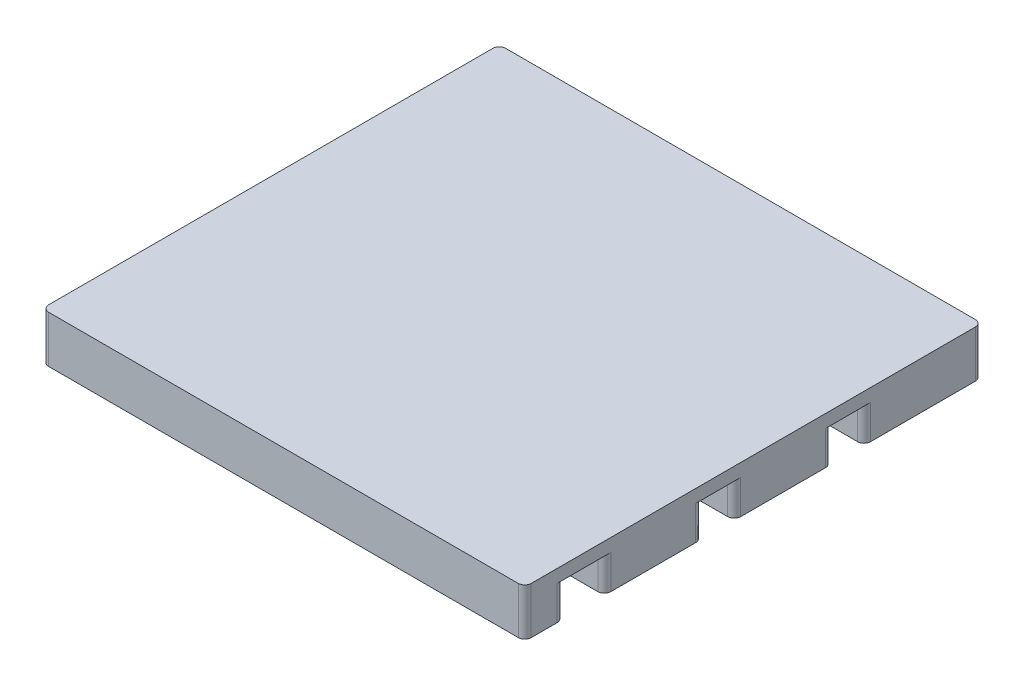
from build123d import *

# Parameters (mm, degrees)
SKETCH3_W           = 149
SKETCH3_H           = 141.12
BOSS_EXTRUDE1_DEPTH = 4
SKETCH5_W           = 67
SKETCH5_H           = 30.2
SKETCH5_H_2         = 36.35
BOSS_EXTRUDE2_DEPTH = 14.5
FILLET1_R           = 2
SKETCH6_W           = 149
SKETCH6_H           = 12
BOSS_EXTRUDE3_DEPTH = 10.5
FILLET2_R           = 2


with BuildPart() as part:
    # Sketch3 → Boss-Extrude1 (new body)
    with BuildSketch(Plane(origin=(0, 0, 0), x_dir=(1, 0, 0), z_dir=(0, 1, 0))):
        with Locations((74.5, -70.56)):
            Rectangle(SKETCH3_W, SKETCH3_H)
    extrude(amount=BOSS_EXTRUDE1_DEPTH)

    # Sketch5 → Boss-Extrude2 (add)
    # profile 1 of 6: a face of its own
    with BuildSketch(Plane(origin=(0, 4, 0), x_dir=(1, 0, 0), z_dir=(0, 1, 0))):
        with Locations((33.5, -23.8)):
            Rectangle(SKETCH5_W, SKETCH5_H)
        with BuildLine():
            ThreePointArc((13, -27.9), (9.9, -24.8), (13, -21.7))
            Line((13, -21.7), (41, -21.7))
            ThreePointArc((41, -21.7), (44.1, -24.8), (41, -27.9))
            Line((41, -27.9), (13, -27.9))
        make_face(mode=Mode.SUBTRACT)
    # profile 2 of 6: a face of its own
    with BuildSketch(Plane(origin=(0, 4, 0), x_dir=(1, 0, 0), z_dir=(0, 1, 0))):
        with Locations((115.5, -18.175)):
            Rectangle(SKETCH5_W, SKETCH5_H_2)
        with BuildLine():
            ThreePointArc((97, -25.35), (93.9, -22.25), (97, -19.15))
            Line((97, -19.15), (125, -19.15))
            ThreePointArc((125, -19.15), (128.1, -22.25), (125, -25.35))
            Line((125, -25.35), (97, -25.35))
        make_face(mode=Mode.SUBTRACT)
    # profile 3 of 6: a face of its own
    with BuildSketch(Plane(origin=(0, 4, 0), x_dir=(1, 0, 0), z_dir=(0, 1, 0))):
        with Locations((33.5, -63.9)):
            Rectangle(SKETCH5_W, SKETCH5_H)
        with BuildLine():
            ThreePointArc((13, -68), (9.9, -64.9), (13, -61.8))
            Line((13, -61.8), (41, -61.8))
            ThreePointArc((41, -61.8), (44.1, -64.9), (41, -68))
            Line((41, -68), (13, -68))
        make_face(mode=Mode.SUBTRACT)
    # profile 4 of 6: a face of its own
    with BuildSketch(Plane(origin=(0, 4, 0), x_dir=(1, 0, 0), z_dir=(0, 1, 0))):
        with Locations((115.5, -61.35)):
            Rectangle(SKETCH5_W, SKETCH5_H)
        with BuildLine():
            ThreePointArc((97, -65.45), (93.9, -62.35), (97, -59.25))
            Line((97, -59.25), (125, -59.25))
            ThreePointArc((125, -59.25), (128.1, -62.35), (125, -65.45))
            Line((125, -65.45), (97, -65.45))
        make_face(mode=Mode.SUBTRACT)
    # profile 5 of 6: a face of its own
    with BuildSketch(Plane(origin=(0, 4, 0), x_dir=(1, 0, 0), z_dir=(0, 1, 0))):
        with Locations((33.5, -104)):
            Rectangle(SKETCH5_W, SKETCH5_H)
        with BuildLine():
            ThreePointArc((13, -108.1), (9.9, -105), (13, -101.9))
            Line((13, -101.9), (41, -101.9))
            ThreePointArc((41, -101.9), (44.1, -105), (41, -108.1))
            Line((41, -108.1), (13, -108.1))
        make_face(mode=Mode.SUBTRACT)
    # profile 6 of 6: a face of its own
    with BuildSketch(Plane(origin=(0, 4, 0), x_dir=(1, 0, 0), z_dir=(0, 1, 0))):
        with Locations((115.5, -101.45)):
            Rectangle(SKETCH5_W, SKETCH5_H)
        with BuildLine():
            ThreePointArc((97, -105.55), (93.9, -102.45), (97, -99.35))
            Line((97, -99.35), (125, -99.35))
            ThreePointArc((125, -99.35), (128.1, -102.45), (125, -105.55))
            Line((125, -105.55), (97, -105.55))
        make_face(mode=Mode.SUBTRACT)
    extrude(amount=-BOSS_EXTRUDE2_DEPTH)

    # Fillet1
    fillet1_edges = [part.edges().sort_by_distance(p)[0] for p in [
        (67, -5.25, 48.8),
        (67, -5.25, 79),
        (0, -5.25, 79),
        (0, -5.25, 48.8),
        (82, -5.25, 46.25),
        (149, -5.25, 46.25),
        (149, -5.25, 76.45),
        (82, -5.25, 76.45),
        (67, -5.25, 88.9),
        (67, -5.25, 119.1),
        (0, -5.25, 119.1),
        (0, -5.25, 88.9),
        (82, -5.25, 86.35),
        (149, -5.25, 86.35),
        (149, -5.25, 116.55),
        (82, -5.25, 116.55),
        (67, -5.25, 8.7),
        (67, -5.25, 38.9),
        (0, -5.25, 38.9),
        (0, -5.25, 8.7),
        (82, -5.25, 0),
        (149, -5.25, 36.35),
        (82, -5.25, 36.35),
        (149, -3.25, 0),
    ]]
    fillet(fillet1_edges, radius=FILLET1_R)

    # Sketch6 → Boss-Extrude3 (add)
    with BuildSketch(Plane.XZ):
        with Locations((74.5, 135.12)):
            Rectangle(SKETCH6_W, SKETCH6_H)
    extrude(amount=BOSS_EXTRUDE3_DEPTH)

    # Fillet2
    fillet2_edges = [part.edges().sort_by_distance(p)[0] for p in [
        (0, -5.25, 129.12),
        (149, -5.25, 129.12),
        (0, 2, 0),
        (149, -3.25, 141.12),
        (0, -3.25, 141.12),
    ]]
    fillet(fillet2_edges, radius=FILLET2_R)


solid = part.part
